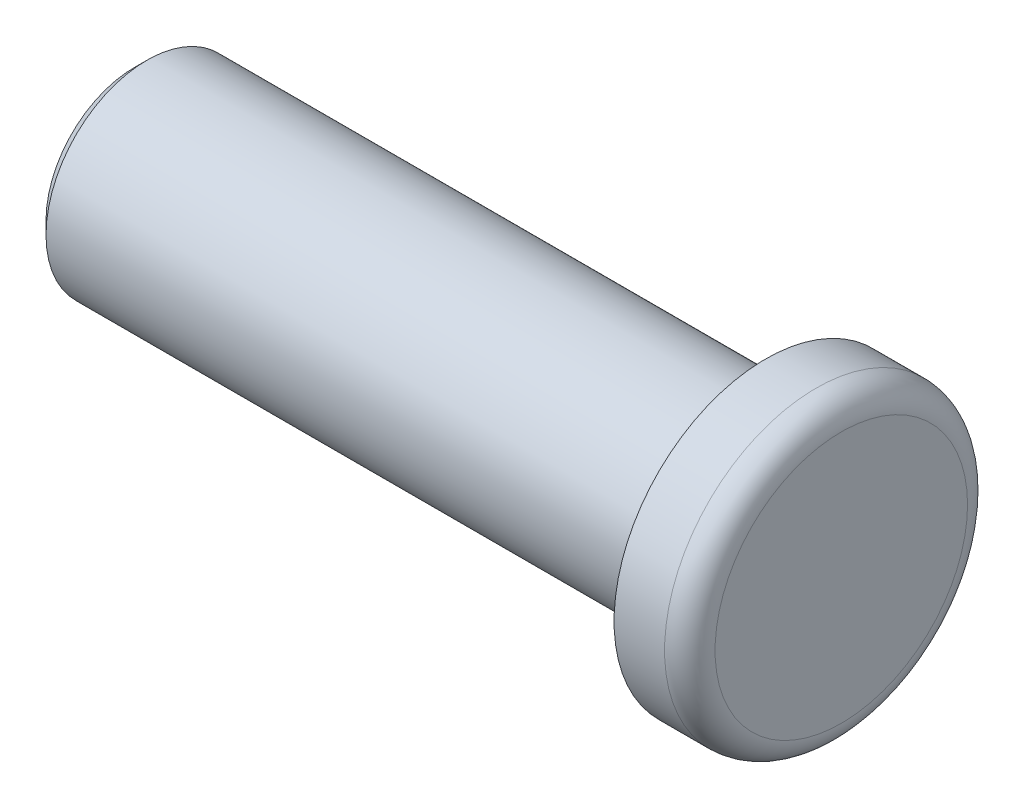
from build123d import *

# Parameters (mm, degrees)
SKETCH1_R           = 6
BOSS_EXTRUDE1_DEPTH = 3
SKETCH3_R           = 4
BOSS_EXTRUDE2_DEPTH = 25
FILLET1_R           = 1
CHAMFER1_SIZE       = 0.5


with BuildPart() as part:
    # Sketch1 → Boss-Extrude1 (new body)
    with BuildSketch(Plane(origin=(0, 0, 0), x_dir=(0, 0, -1), z_dir=(1, 0, 0))):
        Circle(SKETCH1_R)
    extrude(amount=BOSS_EXTRUDE1_DEPTH)

    # Sketch3 → Boss-Extrude2 (add)
    with BuildSketch(Plane.ZY):
        Circle(SKETCH3_R)
    extrude(amount=BOSS_EXTRUDE2_DEPTH)

    # Fillet1
    fillet1_edges = [part.edges().sort_by_distance(p)[0] for p in [
        (3, 0, 6),
    ]]
    fillet(fillet1_edges, radius=FILLET1_R)

    # Chamfer1
    chamfer1_edges = [part.edges().sort_by_distance(p)[0] for p in [
        (-25, 0, -4),
    ]]
    chamfer(chamfer1_edges, length=CHAMFER1_SIZE)


solid = part.part
